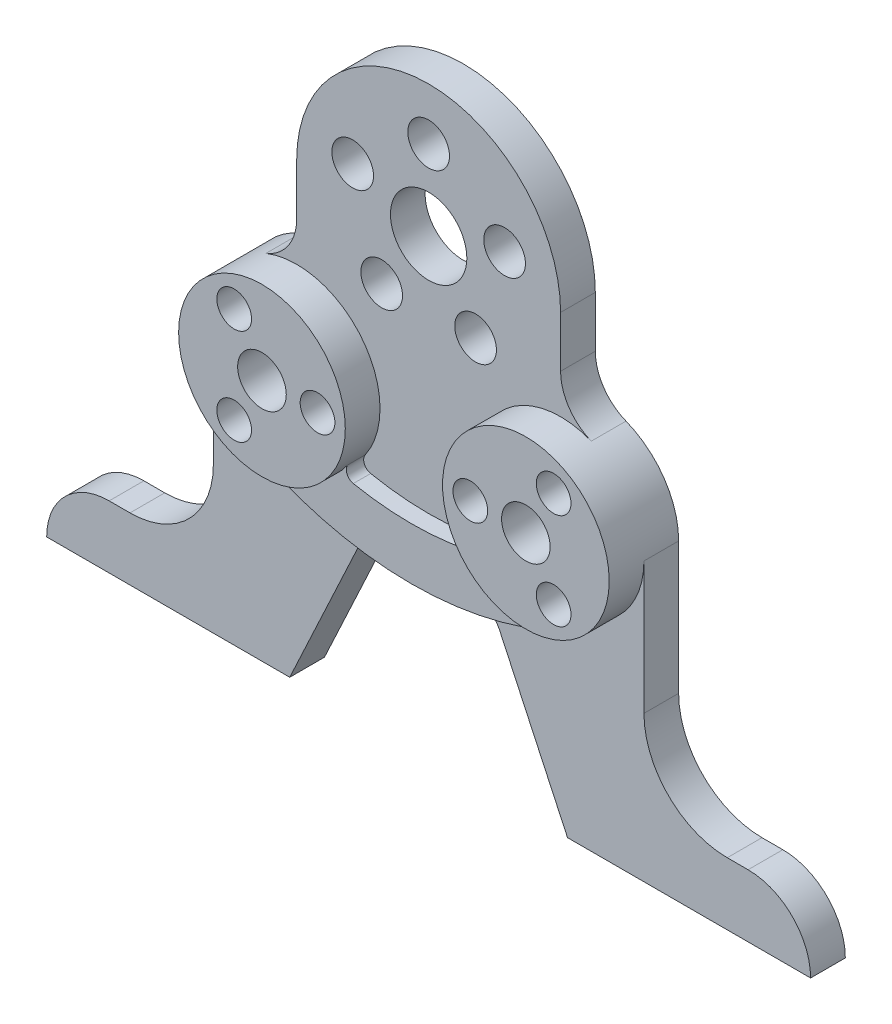
from build123d import *

# Parameters (mm, degrees)
SKETCH_1_R        = 6
SKETCH_1_R_2      = 11
EXTRUDE_1_DEPTH   = 10
EXTRUDE_1_2_DEPTH = 10
EXTRUDE_1_3_DEPTH = 10
EXTRUDE_2_DEPTH   = 15
SKETCH_1_4_R      = 24
SKETCH_1_4_R_2    = 5
SKETCH_1_4_R_3    = 7
EXTRUDE_3_DEPTH   = 20


with BuildPart() as part:
    # Эскиз1 → Бобышка-Вытянуть1 (new body)
    with BuildSketch(Plane.XY):
        with BuildLine():
            ThreePointArc((38, 50), (0, 88), (-38, 50))
            Line((-38, 50), (-38, 35.327043465))
            ThreePointArc((-38, 35.327043465), (-40.419617314, 27.459722648), (-46.842105263, 22.311816925))
            ThreePointArc((-46.842105263, 22.311816925), (-19.210562093, 14.931745483), (-18.261574548, -13.652639329))
            ThreePointArc((-18.261574548, -13.652639329), (-18.523440421, -16.011324994), (-16.696563974, -17.526083803))
            ThreePointArc((-16.696563974, -17.526083803), (0, -19.182069312), (16.696563974, -17.526083803))
            ThreePointArc((16.696563974, -17.526083803), (18.523440421, -16.011324994), (18.261574548, -13.652639329))
            ThreePointArc((18.261574548, -13.652639329), (19.210562093, 14.931745483), (46.842105263, 22.311816925))
            ThreePointArc((46.842105263, 22.311816925), (40.419617314, 27.459722648), (38, 35.327043465))
            Line((38, 35.327043465), (38, 50))
        make_face()
        with Locations((-13.519060803, 31.392609129)):
            Circle(SKETCH_1_R, mode=Mode.SUBTRACT)
        with Locations((0, 50)):
            Circle(SKETCH_1_R_2, mode=Mode.SUBTRACT)
        with Locations((-21.874299875, 57.107390871)):
            Circle(SKETCH_1_R, mode=Mode.SUBTRACT)
        with Locations((0, 73)):
            Circle(SKETCH_1_R, mode=Mode.SUBTRACT)
        with Locations((13.519060803, 31.392609129)):
            Circle(SKETCH_1_R, mode=Mode.SUBTRACT)
        with Locations((21.874299875, 57.107390871)):
            Circle(SKETCH_1_R, mode=Mode.SUBTRACT)
    extrude(amount=EXTRUDE_1_DEPTH)



with BuildPart() as body_2:
    # Эскиз1 → Extrude 1 2 (new body)
    with BuildSketch(Plane.XY):
        with BuildLine():
            ThreePointArc((-50, -20.784609691), (-58.784609691, -12), (-62, 0))
            Line((-62, 0), (-62, -38))
            ThreePointArc((-62, -38), (-69.029437252, -54.970562748), (-86, -62))
            Line((-86, -62), (-92, -62))
            ThreePointArc((-92, -62), (-104.727922061, -67.272077939), (-110, -80))
            Line((-110, -80), (-40, -80))
            Line((-40, -80), (-20.413213913, -37.996001687))
            ThreePointArc((-20.413213913, -37.996001687), (-17.041200429, -34.37997452), (-12.187732979, -33.436586413))
            ThreePointArc((-12.187732979, -33.436586413), (-31.730847168, -29.014307175), (-50, -20.784609691))
        make_face()
    extrude(amount=EXTRUDE_1_2_DEPTH)


with BuildPart() as body_3:
    # Эскиз1 → Extrude 1 3 (new body)
    with BuildSketch(Plane.XY):
        with BuildLine():
            Line((62, -38), (62, 0))
            ThreePointArc((62, 0), (58.784609691, -12), (50, -20.784609691))
            ThreePointArc((50, -20.784609691), (31.730847168, -29.014307175), (12.187732979, -33.436586413))
            ThreePointArc((12.187732979, -33.436586413), (17.041200429, -34.37997452), (20.413213913, -37.996001687))
            Line((20.413213913, -37.996001687), (40, -80))
            Line((40, -80), (110, -80))
            ThreePointArc((110, -80), (104.727922061, -67.272077939), (92, -62))
            Line((92, -62), (86, -62))
            ThreePointArc((86, -62), (69.029437252, -54.970562748), (62, -38))
        make_face()
    extrude(amount=EXTRUDE_1_3_DEPTH)


with BuildPart() as part_1:
    add(part.part)

    add(body_2.part)  # Бобышка-Вытянуть2 merges body 2

    add(body_3.part)  # Бобышка-Вытянуть2 merges body 3
    # Эскиз1<3> → Бобышка-Вытянуть2 (add)
    with BuildSketch(Plane.XY):
        with BuildLine():
            ThreePointArc((-16.696563974, -17.526083803), (-18.523440421, -16.011324994), (-18.261574548, -13.652639329))
            ThreePointArc((-18.261574548, -13.652639329), (-32.738150759, -23.416082989), (-50, -20.784609691))
            ThreePointArc((-50, -20.784609691), (-31.730847168, -29.014307175), (-12.187732979, -33.436586413))
            ThreePointArc((-12.187732979, -33.436586413), (0, -34.182069312), (12.187732979, -33.436586413))
            ThreePointArc((12.187732979, -33.436586413), (31.730847168, -29.014307175), (50, -20.784609691))
            ThreePointArc((50, -20.784609691), (32.738150759, -23.416082989), (18.261574548, -13.652639329))
            ThreePointArc((18.261574548, -13.652639329), (18.523440421, -16.011324994), (16.696563974, -17.526083803))
            ThreePointArc((16.696563974, -17.526083803), (0, -19.182069312), (-16.696563974, -17.526083803))
        make_face()
    extrude(amount=EXTRUDE_2_DEPTH)

    # Эскиз1<4> → Бобышка-Вытянуть3 (add)
    # profile 1 of 2: a face of its own
    with BuildSketch(Plane.XY):
        with Locations((-38, 0)):
            Circle(SKETCH_1_4_R)
        with Locations((-46, -13.856406461)):
            Circle(SKETCH_1_4_R_2, mode=Mode.SUBTRACT)
        with Locations((-38, 0)):
            Circle(SKETCH_1_4_R_3, mode=Mode.SUBTRACT)
        with Locations((-22, 0)):
            Circle(SKETCH_1_4_R_2, mode=Mode.SUBTRACT)
        with Locations((-46, 13.856406461)):
            Circle(SKETCH_1_4_R_2, mode=Mode.SUBTRACT)
    # profile 2 of 2: a face of its own
    with BuildSketch(Plane.XY):
        with Locations((38, 0)):
            Circle(SKETCH_1_4_R)
        with Locations((22, 0)):
            Circle(SKETCH_1_4_R_2, mode=Mode.SUBTRACT)
        with Locations((46, -13.856406461)):
            Circle(SKETCH_1_4_R_2, mode=Mode.SUBTRACT)
        with Locations((38, 0)):
            Circle(SKETCH_1_4_R_3, mode=Mode.SUBTRACT)
        with Locations((46, 13.856406461)):
            Circle(SKETCH_1_4_R_2, mode=Mode.SUBTRACT)
    extrude(amount=EXTRUDE_3_DEPTH)


solid = part_1.part
